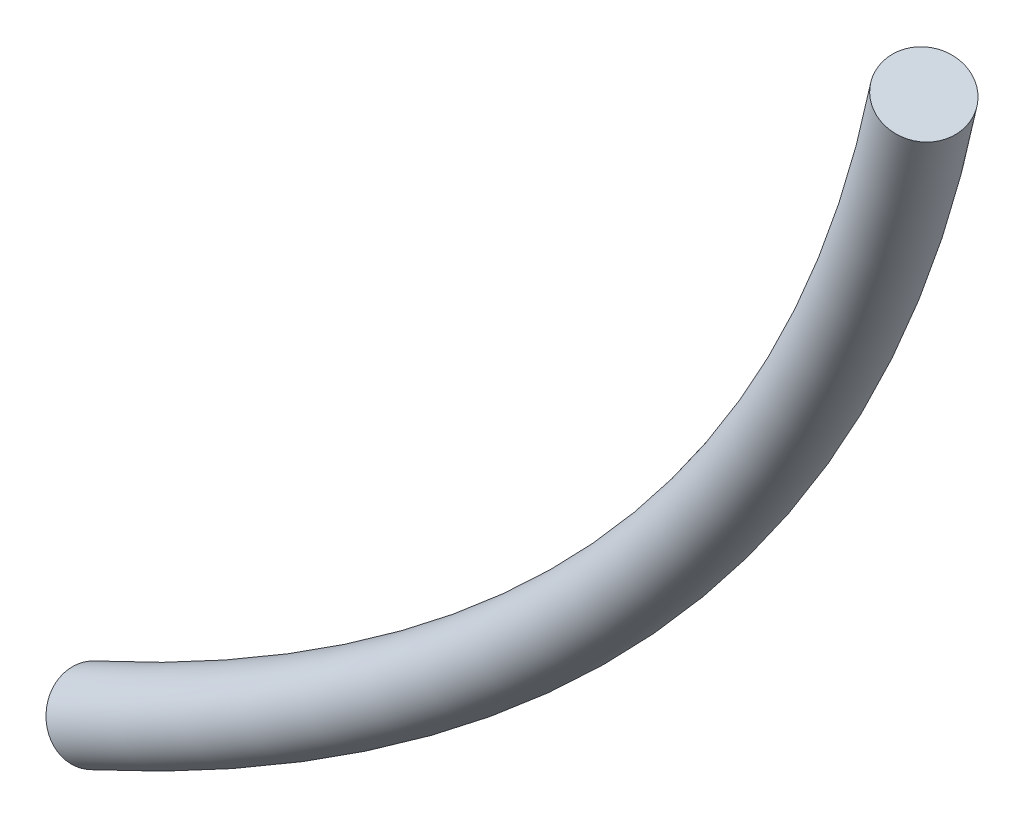
from build123d import *

# Parameters (mm, degrees)
SKETCH3_R = 50.8


with BuildPart() as part:
    # Sweep1: sweep along a path in Sketch2
    with BuildLine(Plane(origin=(307.94198629, 3833.201247056, -14920.045438067), x_dir=(0.9998002541486077, -0.004973290849111862, 0.01935763886711292), z_dir=(-0.019986290410664517, -0.24878541003506124, 0.9683523986386914))) as sweep1_path:
        ThreePointArc((5194.033193265, -8187.962696604), (6134.145642501, -7420.634399311), (6769.786218971, -6386.920129998))
    # Sketch3 → Sweep1 (sweep)
    with BuildSketch(Plane(origin=(406.178088442, 221.746905288, 65.353675045), x_dir=(0.12273699623896678, 0.06700644336738666, -0.9901746140461738), z_dir=(0.869094252093991, 0.4744691215228611, 0.13983645339649795))):
        with Locations((17090.225586253, -6254.797826761)):
            Circle(SKETCH3_R)
    sweep(path=sweep1_path.line)


solid = part.part
